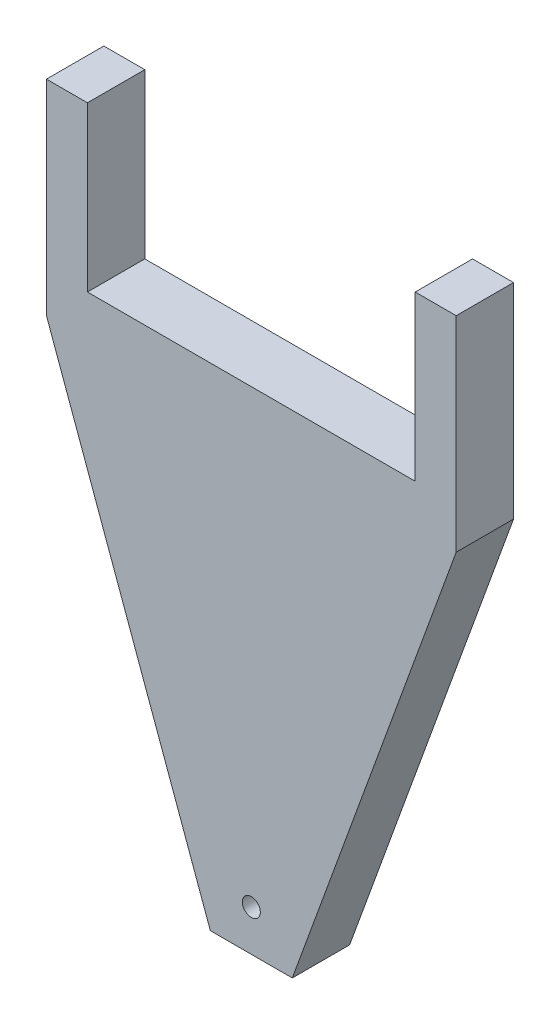
from build123d import *

# Parameters (mm, degrees)
SALIENTE_EXTRUIR1_DEPTH = 7
CROQUIS2_W              = 10
CROQUIS2_H              = 10
CROQUIS2_R              = 1.1
SALIENTE_EXTRUIR2_DEPTH = 7


with BuildPart() as part:
    # Croquis1 → Saliente-Extruir1 (new body)
    with BuildSketch(Plane.XY):
        Polygon((-20, -10), (-20, 10), (-25, 10), (-25, -15), (25, -15), (25, 10), (20, 10), (20, -10), align=None)
    extrude(amount=SALIENTE_EXTRUIR1_DEPTH)

    # Croquis2 → Saliente-Extruir2 (add)
    # profile 1 of 2: a face of its own
    with BuildSketch(Plane.XY.offset(7)):
        Polygon((-5, -70), (-25, -15), (25, -15), (5, -70), (5, -60), (-5, -60), align=None)
    # profile 2 of 2: a face of its own
    with BuildSketch(Plane.XY.offset(7)):
        with Locations((0, -65)):
            Rectangle(CROQUIS2_W, CROQUIS2_H)
        with Locations((0, -65)):
            Circle(CROQUIS2_R, mode=Mode.SUBTRACT)
    extrude(amount=-SALIENTE_EXTRUIR2_DEPTH)


solid = part.part
